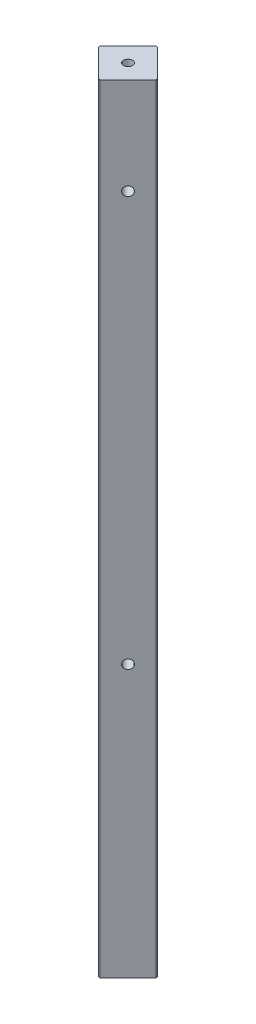
from build123d import *

# Parameters (mm, degrees)
EXTRUSION1_DEPTH          = 282
TROU_TARAUD_M4X0_72_D     = 3.3
TROU_TARAUD_M4X0_72_DEPTH = 17.1
TROU_TARAUD_M4X0_72_TIP   = 0.991420021
TROU_TARAUD_M4X0_73_D     = 3.3
TROU_TARAUD_M4X0_73_DEPTH = 9.1
TROU_TARAUD_M4X0_73_TIP   = 0.991420021
TROU_TARAUD_M4X0_74_D     = 3.3
TROU_TARAUD_M4X0_75_D     = 3.3
TROU_TARAUD_M4X0_76_D     = 3.3


with BuildPart() as part:
    # Esquisse1 → Extrusion1 (new body)
    with BuildSketch(Plane(origin=(0, 0, 0), x_dir=(1, 0, 0), z_dir=(0, 1, 0))):
        with BuildLine():
            Line((0.353553391, 10.253048327), (10.253048327, 0.353553391))
            ThreePointArc((10.253048327, 0.353553391), (10.399494937, 0), (10.253048327, -0.353553391))
            Line((10.253048327, -0.353553391), (0.353553391, -10.253048327))
            ThreePointArc((0.353553391, -10.253048327), (0, -10.399494937), (-0.353553391, -10.253048327))
            Line((-0.353553391, -10.253048327), (-10.253048327, -0.353553391))
            ThreePointArc((-10.253048327, -0.353553391), (-10.399494937, 0), (-10.253048327, 0.353553391))
            Line((-10.253048327, 0.353553391), (-0.353553391, 10.253048327))
            ThreePointArc((-0.353553391, 10.253048327), (0, 10.399494937), (0.353553391, 10.253048327))
        make_face()
    extrude(amount=EXTRUSION1_DEPTH)

    # Trou taraudé M4x0.72
    with Locations(Plane.XZ):
        with Locations((0, 0)):
            Hole(TROU_TARAUD_M4X0_72_D / 2, depth=TROU_TARAUD_M4X0_72_DEPTH)
            with Locations((0, 0, -(TROU_TARAUD_M4X0_72_DEPTH + TROU_TARAUD_M4X0_72_TIP / 2))):  # 118° drill point
                Cone(0, TROU_TARAUD_M4X0_72_D / 2, TROU_TARAUD_M4X0_72_TIP, mode=Mode.SUBTRACT)

    # Trou taraudé M4x0.73
    with Locations(Plane(origin=(0, 282, 0), x_dir=(-1, 0, 0), z_dir=(0, 1, 0))):
        with Locations((0, 0)):
            Hole(TROU_TARAUD_M4X0_73_D / 2, depth=TROU_TARAUD_M4X0_73_DEPTH)
            with Locations((0, 0, -(TROU_TARAUD_M4X0_73_DEPTH + TROU_TARAUD_M4X0_73_TIP / 2))):  # 118° drill point
                Cone(0, TROU_TARAUD_M4X0_73_D / 2, TROU_TARAUD_M4X0_73_TIP, mode=Mode.SUBTRACT)

    # Trou taraudé M4x0.74 (through all)
    with Locations(Plane(origin=(-5.303300859, 0, 5.303300859), x_dir=(0.7071067811865477, 0, 0.7071067811865474), z_dir=(-0.7071067811865474, 0, 0.7071067811865477))):
        with Locations((0, 91), (0, 32)):
            Hole(TROU_TARAUD_M4X0_74_D / 2)

    # Trou taraudé M4x0.75 (through all)
    with Locations(Plane(origin=(-5.303300859, 0, -5.303300859), x_dir=(-0.7071067811865477, 0, 0.7071067811865475), z_dir=(-0.7071067811865475, 0, -0.7071067811865477))):
        with Locations((0, 98.5), (0, 247)):
            Hole(TROU_TARAUD_M4X0_75_D / 2)

    # Trou taraudé M4x0.76 (through all)
    with Locations(Plane(origin=(5.303300859, 0, -5.303300859), x_dir=(-0.7071067811865474, 0, -0.7071067811865477), z_dir=(0.7071067811865477, 0, -0.7071067811865474))):
        with Locations((0, 268.6), (0, 252.6)):
            Hole(TROU_TARAUD_M4X0_76_D / 2)


solid = part.part
